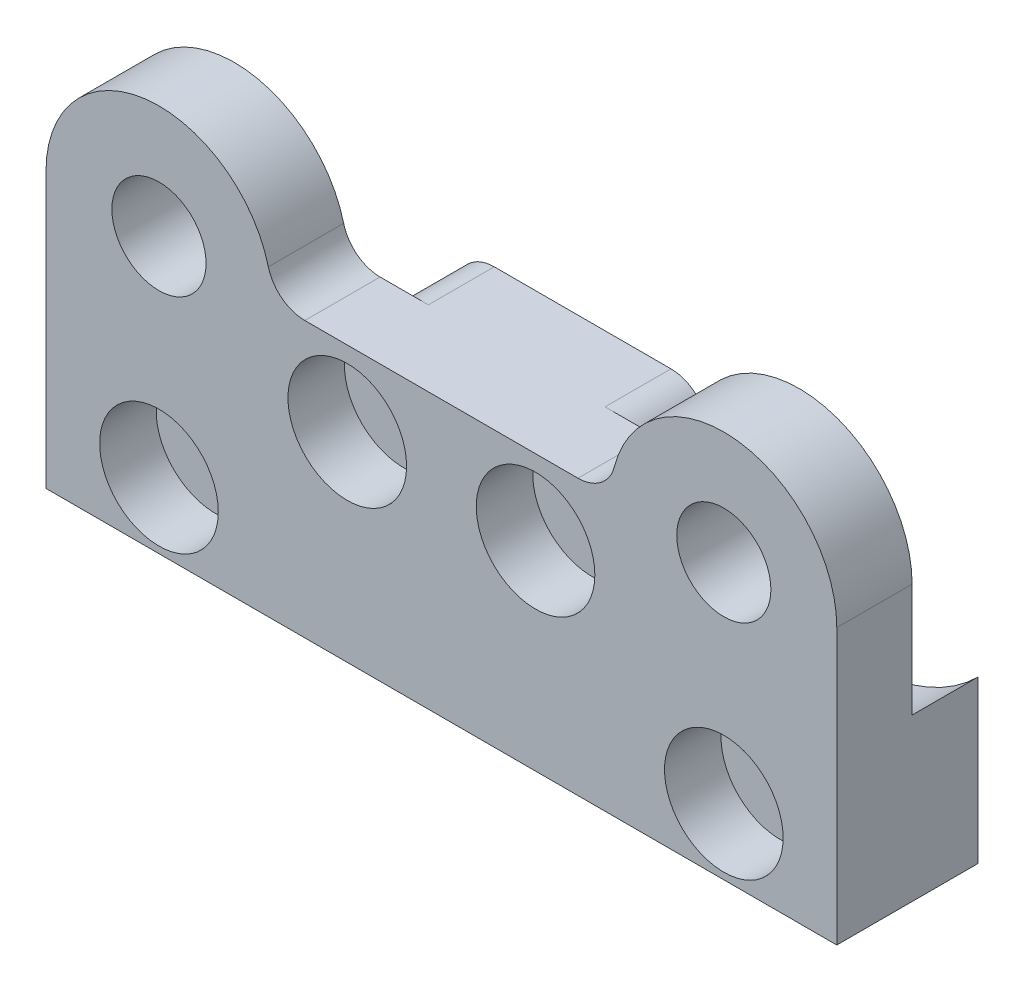
from build123d import *
from build123d.topology import SkipClean

# Parameters (mm, degrees)
SKETCH1_R           = 6
SKETCH1_R_2         = 2.5
BOSS_EXTRUDE1_DEPTH = 4
BOSS_EXTRUDE2_START = 0.8
SKETCH2_R           = 4.25
SKETCH2_R_2         = 2.5
BOSS_EXTRUDE2_DEPTH = 0.8
BOSS_EXTRUDE3_DEPTH = 3.5
SKETCH4_R           = 1.6
CUT_EXTRUDE1_DEPTH  = 61.243221064
SKETCH5_R           = 3.15
CUT_EXTRUDE2_DEPTH  = 3
CHAMFER1_SIZE       = 0.5
FILLET1_R           = 2
BOSS_EXTRUDE4_START = -0.4
SKETCH6_R           = 1.6
BOSS_EXTRUDE4_DEPTH = 0.4


with BuildPart() as part:
    # Sketch1 → Boss-Extrude1 (new body)
    # profile 1 of 3: a face of its own
    with BuildSketch(Plane.XY):
        with BuildLine():
            Line((9, -41.36423576), (-9, -41.36423576))
            ThreePointArc((-9, -41.36423576), (-15, -47.36423576), (-21, -41.36423576))
            Line((-21, -41.36423576), (-21, -55.96423576))
            Line((-21, -55.96423576), (21, -55.96423576))
            Line((21, -55.96423576), (21, -41.36423576))
            ThreePointArc((21, -41.36423576), (15, -47.36423576), (9, -41.36423576))
        make_face()
    # profile 2 of 3: a face of its own
    with BuildSketch(Plane.XY):
        with Locations((-15, -41.36423576)):
            Circle(SKETCH1_R)
        with Locations((-15, -41.36423576)):
            Circle(SKETCH1_R_2, mode=Mode.SUBTRACT)
    # profile 3 of 3: a face of its own
    with BuildSketch(Plane.XY):
        with Locations((15, -41.36423576)):
            Circle(SKETCH1_R)
        with Locations((15, -41.36423576)):
            Circle(SKETCH1_R_2, mode=Mode.SUBTRACT)
    extrude(amount=BOSS_EXTRUDE1_DEPTH)

    # Sketch2 → Boss-Extrude2 (add)
    # profile 1 of 2: a face of its own
    with SkipClean():  # the faces are left unmerged after this step: merging them gives an invalid solid
        with BuildSketch(Plane(origin=(0, 0, 0), x_dir=(-1, 0, 0), z_dir=(0, 0, -1)).offset(BOSS_EXTRUDE2_START)):
            with Locations(Location((-15, -41.36423576, 0), (0, 0, 180))):
                Circle(SKETCH2_R)
            with Locations((-15, -41.36423576)):
                Circle(SKETCH2_R_2, mode=Mode.SUBTRACT)
        # profile 2 of 2: a face of its own
        with BuildSketch(Plane(origin=(0, 0, 0), x_dir=(-1, 0, 0), z_dir=(0, 0, -1)).offset(BOSS_EXTRUDE2_START)):
            with Locations(Location((15, -41.36423576, 0), (0, 0, 180))):
                Circle(SKETCH2_R)
            with Locations((15, -41.36423576)):
                Circle(SKETCH2_R_2, mode=Mode.SUBTRACT)
        extrude(amount=-BOSS_EXTRUDE2_DEPTH)

    # Sketch3 → Boss-Extrude3 (add)
    with SkipClean():  # the faces are left unmerged after this step: merging them gives an invalid solid
        with BuildSketch(Plane(origin=(0, 0, 0), x_dir=(-1, 0, 0), z_dir=(0, 0, -1))):
            with BuildLine():
                ThreePointArc((21, -47.385033049), (11.740398797, -49.214394994), (6.5, -41.36423576))
                Line((6.5, -41.36423576), (-6.5, -41.36423576))
                ThreePointArc((-6.5, -41.36423576), (-11.740398797, -49.214394994), (-21, -47.385033049))
                Line((-21, -47.385033049), (-21, -55.96423576))
                Line((-21, -55.96423576), (21, -55.96423576))
                Line((21, -55.96423576), (21, -47.385033049))
            make_face()
        extrude(amount=BOSS_EXTRUDE3_DEPTH)

    # Sketch4 → Cut-Extrude1 (cut, through all)
    with SkipClean():  # the faces are left unmerged after this step: merging them gives an invalid solid
        with BuildSketch(Plane(origin=(0, 0, -3.5), x_dir=(-1, 0, 0), z_dir=(0, 0, -1))):
            with Locations((-5, -45.36423576)):
                Circle(SKETCH4_R)
            with Locations((-15, -52.46423576)):
                Circle(SKETCH4_R)
            with Locations(Location((15, -52.46423576, 0), (0, 0, 180))):
                Circle(SKETCH4_R)
            with Locations(Location((5, -45.36423576, 0), (0, 0, 180))):
                Circle(SKETCH4_R)
        extrude(amount=-CUT_EXTRUDE1_DEPTH, mode=Mode.SUBTRACT)

    # Sketch5 → Cut-Extrude2 (cut)
    with SkipClean():  # the faces are left unmerged after this step: merging them gives an invalid solid
        with BuildSketch(Plane.XY.offset(4)):
            with Locations((-5, -45.36423576)):
                Circle(SKETCH5_R)
            with Locations((5, -45.36423576)):
                Circle(SKETCH5_R)
            with Locations((15, -52.46423576)):
                Circle(SKETCH5_R)
            with Locations((-15, -52.46423576)):
                Circle(SKETCH5_R)
        extrude(amount=-CUT_EXTRUDE2_DEPTH, mode=Mode.SUBTRACT)

    # Chamfer1
    chamfer1_edges = [part.edges().sort_by_distance(p)[0] for p in [
        (10.75, -41.36423576, -0.8),
        (-19.25, -41.36423576, -0.8),
    ]]
    chamfer(chamfer1_edges, length=CHAMFER1_SIZE)

    # Fillet1
    fillet1_edges = [part.edges().sort_by_distance(p)[0] for p in [
        (9, -41.36423576, 2),
        (-9, -41.36423576, 2),
        (-6.5, -41.36423576, -1.75),
        (6.5, -41.36423576, -1.75),
    ]]
    fillet(fillet1_edges, radius=FILLET1_R)

    # Sketch6 → Boss-Extrude4 (add)
    with SkipClean():  # the faces are left unmerged after this step: merging them gives an invalid solid
        with BuildSketch(Plane.XY.offset(1).offset(BOSS_EXTRUDE4_START)):
            with Locations(Location((15, -52.46423576, 0), (0, 0, 180))):
                Circle(SKETCH6_R)
            with Locations(Location((5, -45.36423576, 0), (0, 0, 180))):
                Circle(SKETCH6_R)
            with Locations((-15, -52.46423576)):
                Circle(SKETCH6_R)
            with Locations((-5, -45.36423576)):
                Circle(SKETCH6_R)
        extrude(amount=BOSS_EXTRUDE4_DEPTH)


solid = part.part
